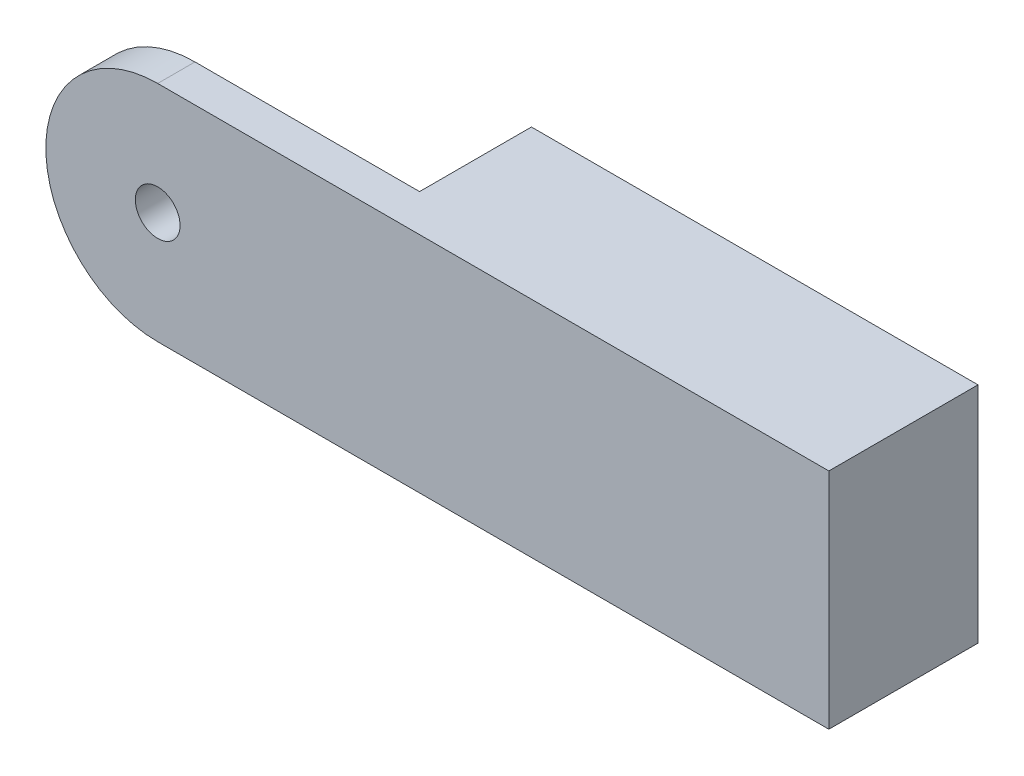
from build123d import *

# Parameters (mm, degrees)
SKETCH_1_R          = 3
EXTRUDE_1_DEPTH     = 20
SKETCH_2_W          = 31.985989971
SKETCH_2_H          = 30
CUT_EXTRUDE_2_DEPTH = 64.639610307
SKETCH_3_W          = 45
SKETCH_3_H          = 30
CUT_EXTRUDE_3_DEPTH = 64.639610307


with BuildPart() as part:
    # 草图1 → 凸台-拉伸1 (new body)
    with BuildSketch(Plane.XY):
        with BuildLine():
            Line((-45, 15), (45, 15))
            Line((45, 15), (45, -15))
            Line((45, -15), (-45, -15))
            ThreePointArc((-45, -15), (-60, 0), (-45, 15))
        make_face()
        with Locations((-45, 0)):
            Circle(SKETCH_1_R, mode=Mode.SUBTRACT)
    extrude(amount=EXTRUDE_1_DEPTH)

    # 草图2 → 切除-拉伸2 (cut, through all)
    with BuildSketch(Plane.XY.offset(15)):
        with Locations((-45.637141889, 0)):
            Rectangle(SKETCH_2_W, SKETCH_2_H)
    extrude(amount=-CUT_EXTRUDE_2_DEPTH, mode=Mode.SUBTRACT)

    # 草图3 → 切除-拉伸3 (cut, through all)
    with BuildSketch(Plane.XY.offset(15)):
        with Locations((-37.384024781, 0)):
            Rectangle(SKETCH_3_W, SKETCH_3_H)
    extrude(amount=-CUT_EXTRUDE_3_DEPTH, mode=Mode.SUBTRACT)


solid = part.part
